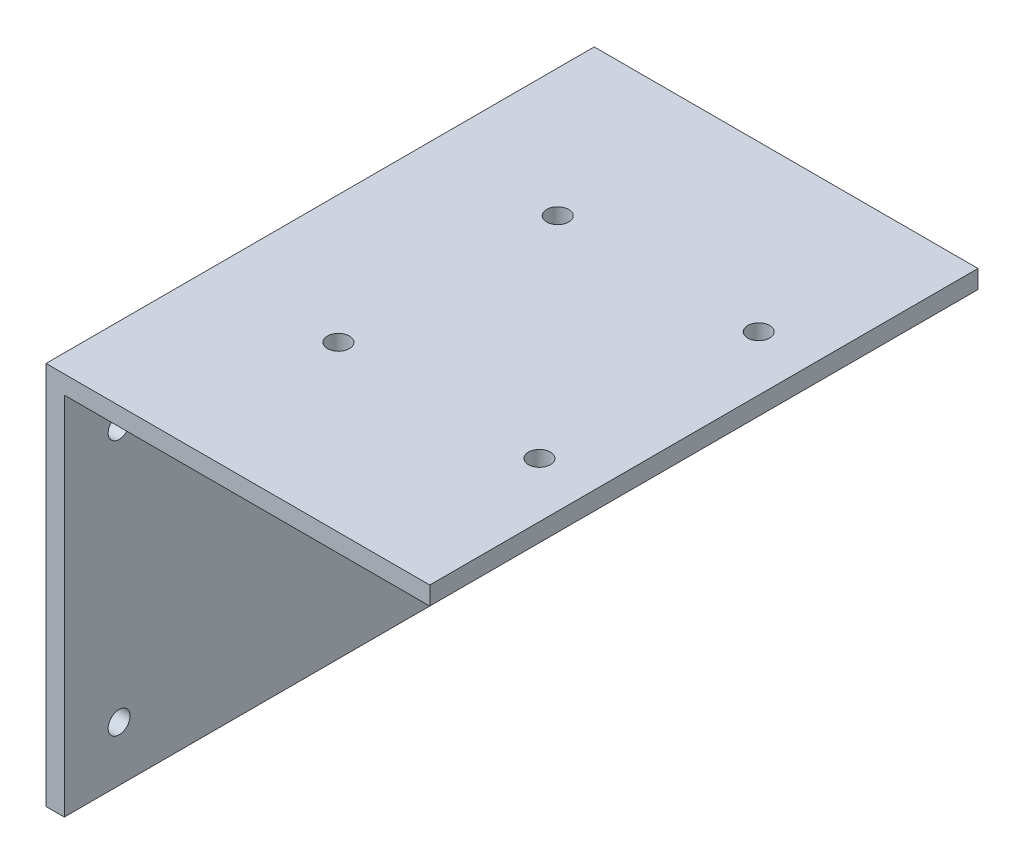
from build123d import *

# Parameters (mm, degrees)
BOSS_EXTRUDE1_DEPTH = 150
CUT_EXTRUDE1_REACH  = 210.626
SKETCH2_R           = 3
CUT_EXTRUDE2_REACH  = 210.626
SKETCH3_R           = 3


with BuildPart() as part:
    # Sketch1 → Boss-Extrude1 (new body)
    with BuildSketch(Plane.XY):
        Polygon((0, 0), (0, 105), (105, 105), (105, 100), (5, 100), (5, 0), align=None)
    extrude(amount=BOSS_EXTRUDE1_DEPTH)

    # Sketch2 → Cut-Extrude1 (cut, up to next)
    with BuildSketch(Plane(origin=(5, 0, 0), x_dir=(0, 0, -1), z_dir=(1, 0, 0)), mode=Mode.PRIVATE) as cut_extrude1_sk1:
        with Locations(Location((-135, 85, 0), (0, 0, 90))):
            Circle(SKETCH2_R)
    cut_extrude1_tool1 = extrude(cut_extrude1_sk1.sketch, amount=-CUT_EXTRUDE1_REACH, mode=Mode.PRIVATE) & part.part
    # Sketch2 → Cut-Extrude1 (cut, up to next)
    with BuildSketch(Plane(origin=(5, 0, 0), x_dir=(0, 0, -1), z_dir=(1, 0, 0)), mode=Mode.PRIVATE) as cut_extrude1_sk2:
        with Locations((-15, 85)):
            Circle(SKETCH2_R)
    cut_extrude1_tool2 = extrude(cut_extrude1_sk2.sketch, amount=-CUT_EXTRUDE1_REACH, mode=Mode.PRIVATE) & part.part
    # Sketch2 → Cut-Extrude1 (cut, up to next)
    with BuildSketch(Plane(origin=(5, 0, 0), x_dir=(0, 0, -1), z_dir=(1, 0, 0)), mode=Mode.PRIVATE) as cut_extrude1_sk3:
        with Locations(Location((-15, 15, 0), (0, 0, 90))):
            Circle(SKETCH2_R)
    cut_extrude1_tool3 = extrude(cut_extrude1_sk3.sketch, amount=-CUT_EXTRUDE1_REACH, mode=Mode.PRIVATE) & part.part
    # Sketch2 → Cut-Extrude1 (cut, up to next)
    with BuildSketch(Plane(origin=(5, 0, 0), x_dir=(0, 0, -1), z_dir=(1, 0, 0)), mode=Mode.PRIVATE) as cut_extrude1_sk4:
        with Locations((-135, 15)):
            Circle(SKETCH2_R)
    cut_extrude1_tool4 = extrude(cut_extrude1_sk4.sketch, amount=-CUT_EXTRUDE1_REACH, mode=Mode.PRIVATE) & part.part
    add(cut_extrude1_tool1.solids().sort_by_distance((5, 85, 135))[0], mode=Mode.SUBTRACT)
    add(cut_extrude1_tool2.solids().sort_by_distance((5, 85, 15))[0], mode=Mode.SUBTRACT)
    add(cut_extrude1_tool3.solids().sort_by_distance((5, 15, 15))[0], mode=Mode.SUBTRACT)
    add(cut_extrude1_tool4.solids().sort_by_distance((5, 15, 135))[0], mode=Mode.SUBTRACT)

    # Sketch3 → Cut-Extrude2 (cut, up to next)
    with BuildSketch(Plane.XZ.offset(-100), mode=Mode.PRIVATE) as cut_extrude2_sk1:
        with Locations((35, 105)):
            Circle(SKETCH3_R)
    cut_extrude2_tool1 = extrude(cut_extrude2_sk1.sketch, amount=-CUT_EXTRUDE2_REACH, mode=Mode.PRIVATE) & part.part
    # Sketch3 → Cut-Extrude2 (cut, up to next)
    with BuildSketch(Plane.XZ.offset(-100), mode=Mode.PRIVATE) as cut_extrude2_sk2:
        with Locations((90, 105)):
            Circle(SKETCH3_R)
    cut_extrude2_tool2 = extrude(cut_extrude2_sk2.sketch, amount=-CUT_EXTRUDE2_REACH, mode=Mode.PRIVATE) & part.part
    # Sketch3 → Cut-Extrude2 (cut, up to next)
    with BuildSketch(Plane.XZ.offset(-100), mode=Mode.PRIVATE) as cut_extrude2_sk3:
        with Locations((90, 45)):
            Circle(SKETCH3_R)
    cut_extrude2_tool3 = extrude(cut_extrude2_sk3.sketch, amount=-CUT_EXTRUDE2_REACH, mode=Mode.PRIVATE) & part.part
    # Sketch3 → Cut-Extrude2 (cut, up to next)
    with BuildSketch(Plane.XZ.offset(-100), mode=Mode.PRIVATE) as cut_extrude2_sk4:
        with Locations((35, 45)):
            Circle(SKETCH3_R)
    cut_extrude2_tool4 = extrude(cut_extrude2_sk4.sketch, amount=-CUT_EXTRUDE2_REACH, mode=Mode.PRIVATE) & part.part
    add(cut_extrude2_tool1.solids().sort_by_distance((35, 100, 105))[0], mode=Mode.SUBTRACT)
    add(cut_extrude2_tool2.solids().sort_by_distance((90, 100, 105))[0], mode=Mode.SUBTRACT)
    add(cut_extrude2_tool3.solids().sort_by_distance((90, 100, 45))[0], mode=Mode.SUBTRACT)
    add(cut_extrude2_tool4.solids().sort_by_distance((35, 100, 45))[0], mode=Mode.SUBTRACT)


solid = part.part
